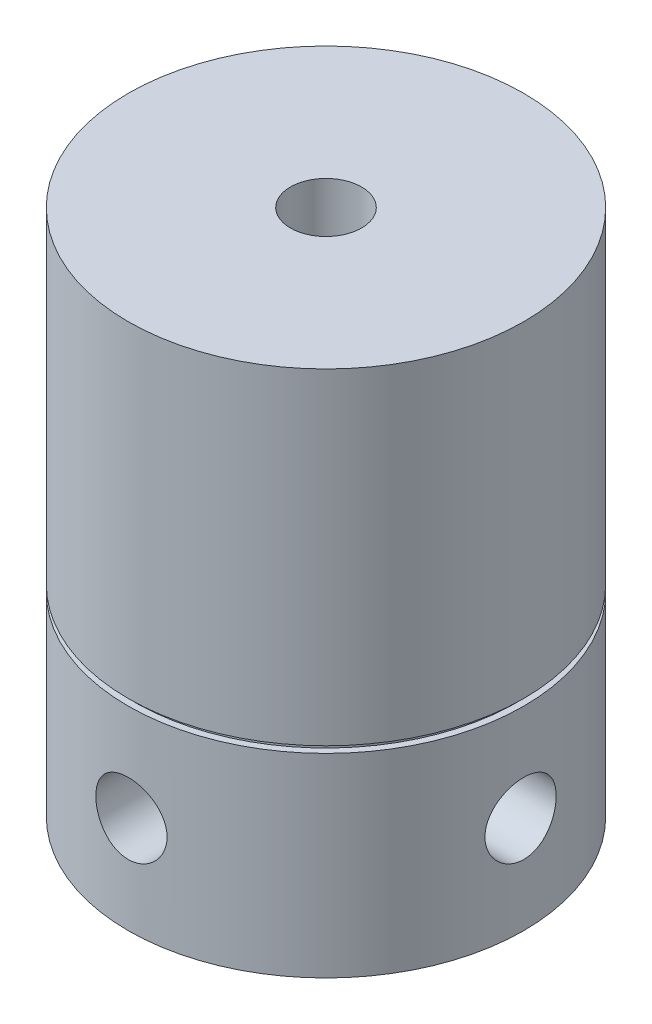
from build123d import *

# Parameters (mm, degrees)
CUT_EXTRUDE1_DEPTH      = 116.003391254
CUT_EXTRUDE1_DEPTH_BACK = 116.003391254
SKETCH4_R               = 6.858
SKETCH5_R               = 6.858
CUT_EXTRUDE2_DEPTH      = 116.003391321
SKETCH5_3_R             = 10.668
CUT_EXTRUDE3_DEPTH      = 116.003391321
SKETCH6_R               = 6.858
CUT_EXTRUDE4_DEPTH      = 25.4


with BuildPart() as part:
    # Sketch3 → Revolve1 (revolve)
    with BuildSketch(Plane.XY):
        Polygon((0, 101.6), (0, 0), (38.1, 0), (38.1, 37.465), (36.83, 37.465), (36.83, 38.735), (38.1, 38.735), (38.1, 101.6), align=None)
    revolve(axis=Axis((0, 101.6, 0), (0, -1, 0)))

    # Sketch4 → Cut-Extrude1 (cut, two sides: drawn at the far end of the back side and taken through both)
    with BuildSketch(Plane.XY.offset(-CUT_EXTRUDE1_DEPTH_BACK)):
        with Locations((0, 18.7325)):
            Circle(SKETCH4_R)
    extrude(amount=CUT_EXTRUDE1_DEPTH + CUT_EXTRUDE1_DEPTH_BACK, mode=Mode.SUBTRACT)

    # Sketch5 → Cut-Extrude2 (cut, through all)
    with BuildSketch(Plane(origin=(0, 0, 0), x_dir=(0, 0, -1), z_dir=(1, 0, 0))):
        with Locations((0, 18.7325)):
            Circle(SKETCH5_R)
    extrude(amount=CUT_EXTRUDE2_DEPTH, mode=Mode.SUBTRACT)

    # Sketch5<3> → Cut-Extrude3 (cut, through all)
    with BuildSketch(Plane(origin=(0, 0, 0), x_dir=(0, 0, -1), z_dir=(1, 0, 0))):
        with Locations((0, 18.7325)):
            Circle(SKETCH5_3_R)
    extrude(amount=-CUT_EXTRUDE3_DEPTH, mode=Mode.SUBTRACT)

    # Sketch6 → Cut-Extrude4 (cut)
    with BuildSketch(Plane(origin=(0, 101.6, 0), x_dir=(1, 0, 0), z_dir=(0, 1, 0))):
        Circle(SKETCH6_R)
    extrude(amount=-CUT_EXTRUDE4_DEPTH, mode=Mode.SUBTRACT)


solid = part.part
